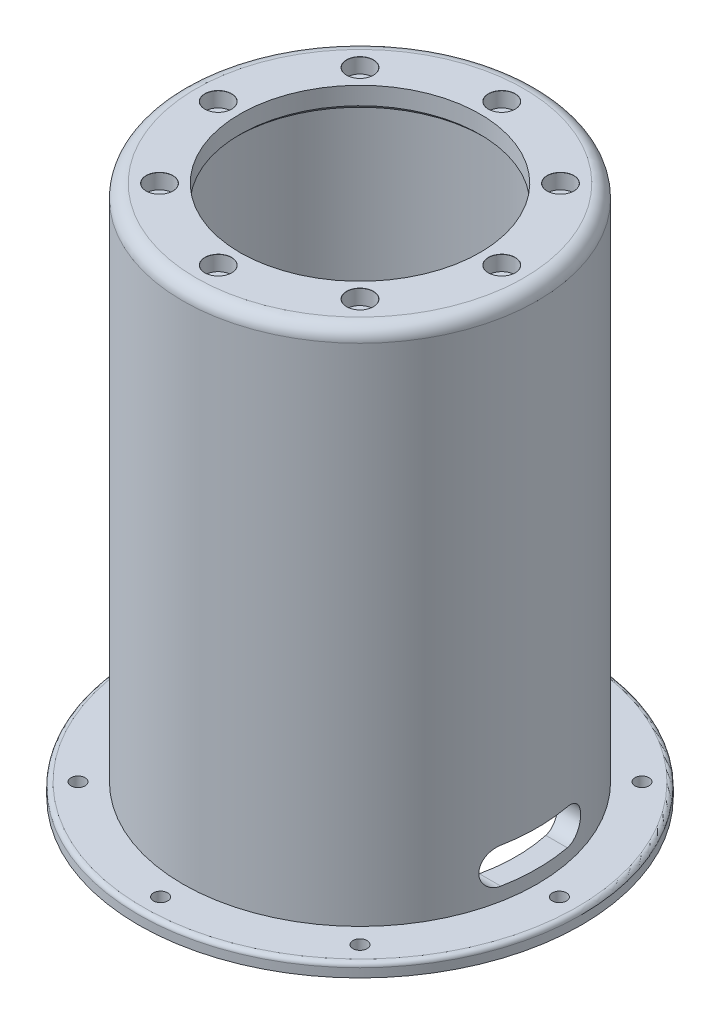
from build123d import *

# Parameters (mm, degrees)
SKETCH_1_R               = 40
EXTRUDE_1_DEPTH          = 120
SKETCH_2_R               = 35.25
CUT_EXTRUDE_1_DEPTH      = 115
SKETCH_3_R               = 27.1
CUT_EXTRUDE_2_DEPTH      = 133.664991614
PATTERN_CIRCULAR_1_COUNT = 8
SKETCH_7_R               = 50
SKETCH_7_R_2             = 40
EXTRUDE_2_DEPTH          = 3
SKETCH_8_R               = 1.6
CUT_EXTRUDE_3_DEPTH      = 137.707717412
PATTERN_CIRCULAR_2_COUNT = 8
FILLET_1_R               = 3
CHAMFER_1_SIZE           = 1
FILLET_2_R               = 1
CUT_EXTRUDE_4_DEPTH      = 159.11388304


with BuildPart() as part:
    # 草图1 → 凸台-拉伸1 (new body)
    with BuildSketch(Plane(origin=(0, 0, 0), x_dir=(1, 0, 0), z_dir=(0, 1, 0))):
        with Locations(Location((0, 0, 0), (0, 0, 270))):
            Circle(SKETCH_1_R)
    extrude(amount=EXTRUDE_1_DEPTH)

    # 草图2 → 切除-拉伸1 (cut)
    with BuildSketch(Plane.XZ):
        with Locations(Location((0, 0, 0), (0, 0, 270))):
            Circle(SKETCH_2_R)
    extrude(amount=-CUT_EXTRUDE_1_DEPTH, mode=Mode.SUBTRACT)

    # 草图3 → 切除-拉伸2 (cut, through all)
    with BuildSketch(Plane(origin=(0, 120, 0), x_dir=(1, 0, 0), z_dir=(0, 1, 0))):
        with Locations(Location((0, 0, 0), (0, 0, 270))):
            Circle(SKETCH_3_R)
    extrude(amount=-CUT_EXTRUDE_2_DEPTH, mode=Mode.SUBTRACT)

    # 草图6 → 打孔尺寸(%根据)内六角圆柱头螺钉的类型1 (revolve, cut)
    with BuildSketch(Plane(origin=(0, 120, -32), x_dir=(0, 0, 1), z_dir=(1, 0, 0))):
        Polygon((0, 0), (0, 120), (1.7, 120), (1.7, 3.4), (3, 3.4), (3, 0.025), (3.025, 0), align=None)
    hole_wizard_1 = revolve(axis=Axis((0, 126.35, -32), (0, -1, 0)), mode=Mode.SUBTRACT)

    # 阵列(圆周)1: 打孔尺寸(%根据)内六角圆柱头螺钉的类型1 ×8 about axis
    pattern_circular_1_axis = Axis((0, 0, 0), (0, 1, 0))
    for i in range(1, PATTERN_CIRCULAR_1_COUNT):
        add(hole_wizard_1.rotate(pattern_circular_1_axis, i * 360 / PATTERN_CIRCULAR_1_COUNT), mode=Mode.SUBTRACT)

    # 草图7 → 凸台-拉伸2 (add)
    with BuildSketch(Plane.XZ):
        with Locations(Location((0, 0, 0), (0, 0, 270))):
            Circle(SKETCH_7_R)
        with Locations(Location((0, 0, 0), (0, 0, 270))):
            Circle(SKETCH_7_R_2, mode=Mode.SUBTRACT)
    extrude(amount=-EXTRUDE_2_DEPTH)

    # 草图8 → 切除-拉伸3 (cut, through all)
    with BuildSketch(Plane(origin=(0, 3, 0), x_dir=(1, 0, 0), z_dir=(0, 1, 0))):
        with Locations(Location((0, -45, 0), (0, 0, 270))):
            Circle(SKETCH_8_R)
    cut_extrude_3 = extrude(amount=-CUT_EXTRUDE_3_DEPTH, mode=Mode.SUBTRACT)

    # 阵列(圆周)2: 切除-拉伸3 ×8 about axis
    pattern_circular_2_axis = Axis((0, 0, 0), (0, 1, 0))
    for i in range(1, PATTERN_CIRCULAR_2_COUNT):
        add(cut_extrude_3.rotate(pattern_circular_2_axis, i * 360 / PATTERN_CIRCULAR_2_COUNT), mode=Mode.SUBTRACT)

    # 圆角1
    fillet_1_edges = [part.edges().sort_by_distance(p)[0] for p in [
        (0, 120, -40),
    ]]
    fillet(fillet_1_edges, radius=FILLET_1_R)

    # 倒角1
    chamfer_1_edges = [part.edges().sort_by_distance(p)[0] for p in [
        (0, 115, -27.1),
        (0, 0, 35.25),
    ]]
    chamfer(chamfer_1_edges, length=CHAMFER_1_SIZE)

    # 圆角2
    fillet_2_edges = [part.edges().sort_by_distance(p)[0] for p in [
        (0, 3, 50),
    ]]
    fillet(fillet_2_edges, radius=FILLET_2_R)

    # 草图9 → 切除-拉伸4 (cut, through all)
    with BuildSketch(Plane(origin=(40, 0, 0), x_dir=(0, 0, -1), z_dir=(1, 0, 0))):
        with BuildLine():
            Line((-7.5, 14), (7.5, 14))
            ThreePointArc((7.5, 14), (11.5, 10), (7.5, 6))
            Line((7.5, 6), (-7.5, 6))
            ThreePointArc((-7.5, 6), (-11.5, 10), (-7.5, 14))
        make_face()
    extrude(amount=-CUT_EXTRUDE_4_DEPTH, mode=Mode.SUBTRACT)


solid = part.part
